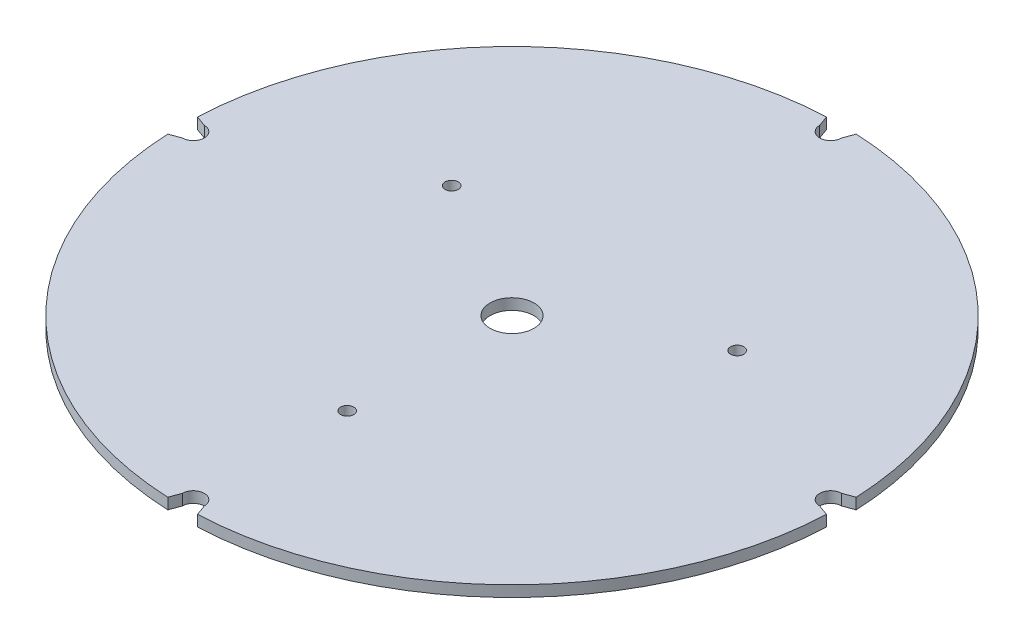
from build123d import *

# Parameters (mm, degrees)
SKETCH1_R               = 10
BOSS_EXTRUDE1_DEPTH     = 5
CUT_EXTRUDE1_DEPTH      = 212.975206598
CUT_EXTRUDE1_DEPTH_BACK = 212.975206598
SKETCH2_R               = 3


with BuildPart() as part:
    # Sketch1 → Boss-Extrude1 (new body)
    with BuildSketch(Plane(origin=(0, 0, 0), x_dir=(1, 0, 0), z_dir=(0, 1, 0))):
        with BuildLine():
            ThreePointArc((5, 145), (0, 140), (-5, 145))
            Line((-5, 145), (-6.764310309, 149.847402734))
            ThreePointArc((-6.764310309, 149.847402734), (-106.066017178, 106.066017178), (-149.847402734, 6.764310309))
            Line((-149.847402734, 6.764310309), (-145, 5))
            ThreePointArc((-145, 5), (-141.464466094, 3.535533906), (-140, 0))
            ThreePointArc((-140, 0), (-141.464466094, -3.535533906), (-145, -5))
            Line((-145, -5), (-149.847402734, -6.764310309))
            ThreePointArc((-149.847402734, -6.764310309), (-106.066017178, -106.066017178), (-6.764310309, -149.847402734))
            Line((-6.764310309, -149.847402734), (-5, -145))
            ThreePointArc((-5, -145), (0, -140), (5, -145))
            Line((5, -145), (6.764310309, -149.847402734))
            ThreePointArc((6.764310309, -149.847402734), (106.066017178, -106.066017178), (149.847402734, -6.764310309))
            Line((149.847402734, -6.764310309), (145, -5))
            ThreePointArc((145, -5), (140, 0), (145, 5))
            Line((145, 5), (149.847402734, 6.764310309))
            ThreePointArc((149.847402734, 6.764310309), (106.066017178, 106.066017178), (6.764310309, 149.847402734))
            Line((6.764310309, 149.847402734), (5, 145))
        make_face()
        with Locations(Location((0, 0, 0), (0, 0, 270))):
            Circle(SKETCH1_R, mode=Mode.SUBTRACT)
    extrude(amount=BOSS_EXTRUDE1_DEPTH)

    # Sketch2 → Cut-Extrude1 (cut, two sides: drawn at the far end of the back side and taken through both)
    with BuildSketch(Plane(origin=(0, 5, 0), x_dir=(1, 0, 0), z_dir=(0, 1, 0)).offset(-CUT_EXTRUDE1_DEPTH_BACK)):
        with Locations(Location((0, -75, 0), (0, 0, 270))):
            Circle(SKETCH2_R)
        with Locations(Location((64.951905284, 37.5, 0), (0, 0, 270))):
            Circle(SKETCH2_R)
        with Locations(Location((-64.951905284, 37.5, 0), (0, 0, 270))):
            Circle(SKETCH2_R)
    extrude(amount=CUT_EXTRUDE1_DEPTH + CUT_EXTRUDE1_DEPTH_BACK, mode=Mode.SUBTRACT)


solid = part.part
